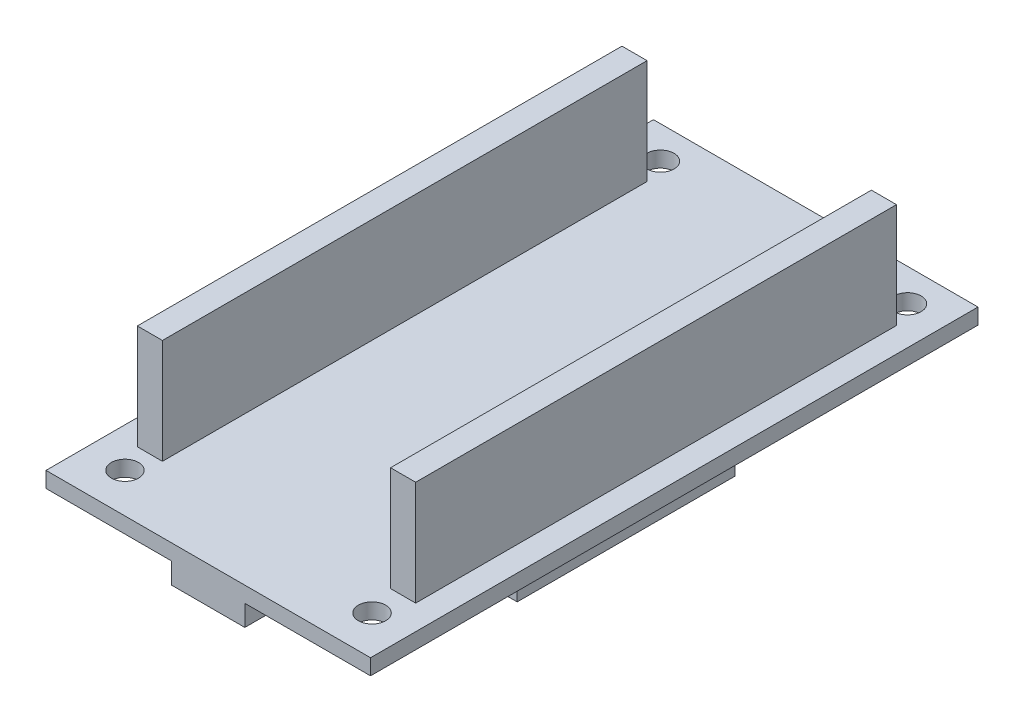
from build123d import *

# Parameters (mm, degrees)
SKETCH1_W           = 31.001294418
SKETCH1_H           = 58.025746404
SKETCH1_R           = 1.3
BOSS_EXTRUDE1_DEPTH = 1.5
SKETCH2_W           = 6.985889014
SKETCH2_H           = 7.403537408
BOSS_EXTRUDE2_DEPTH = 2
SKETCH3_W           = 2.398141005
SKETCH3_H           = 46.294548095
SKETCH3_H_2         = 45.929613594
BOSS_EXTRUDE3_DEPTH = 10
SKETCH4_W           = 1.668272003
SKETCH4_H           = 20.801266543
BOSS_EXTRUDE4_DEPTH = 2


with BuildPart() as part:
    # Sketch1 → Boss-Extrude1 (new body)
    with BuildSketch(Plane(origin=(0, 0, 0), x_dir=(1, 0, 0), z_dir=(0, 1, 0))):
        with Locations((11.734043017, 25.235374996)):
            Rectangle(SKETCH1_W, SKETCH1_H)
        with Locations(Location((0, 0, 0), (0, 0, 270))):
            Circle(SKETCH1_R, mode=Mode.SUBTRACT)
        with Locations(Location((23.6, 0, 0), (0, 0, 270))):
            Circle(SKETCH1_R, mode=Mode.SUBTRACT)
        with Locations(Location((23.6, 51.15, 0), (0, 0, 270))):
            Circle(SKETCH1_R, mode=Mode.SUBTRACT)
        with Locations(Location((0, 51.15, 0), (0, 0, 270))):
            Circle(SKETCH1_R, mode=Mode.SUBTRACT)
    extrude(amount=BOSS_EXTRUDE1_DEPTH)

    # Sketch2 → Boss-Extrude2 (add)
    with BuildSketch(Plane(origin=(0, 0, 0), x_dir=(-1, 0, 0), z_dir=(0, -1, 0))):
        with Locations((-11.734043017, -0.075729502)):
            Rectangle(SKETCH2_W, SKETCH2_H)
    extrude(amount=BOSS_EXTRUDE2_DEPTH)

    # Sketch3 → Boss-Extrude3 (add)
    with BuildSketch(Plane(origin=(0, 1.5, 0), x_dir=(1, 0, 0), z_dir=(0, 1, 0))):
        with Locations((-0.152395008, 25.678509747)):
            Rectangle(SKETCH3_W, SKETCH3_H)
        with Locations((23.672614542, 25.860976997)):
            Rectangle(SKETCH3_W, SKETCH3_H_2)
    extrude(amount=BOSS_EXTRUDE3_DEPTH)

    # Sketch4 → Boss-Extrude4 (add)
    with BuildSketch(Plane(origin=(0, 0, 0), x_dir=(-1, 0, 0), z_dir=(0, -1, 0))):
        with Locations((-25.288753045, 21.742430489)):
            Rectangle(SKETCH4_W, SKETCH4_H)
    extrude(amount=BOSS_EXTRUDE4_DEPTH)


solid = part.part
